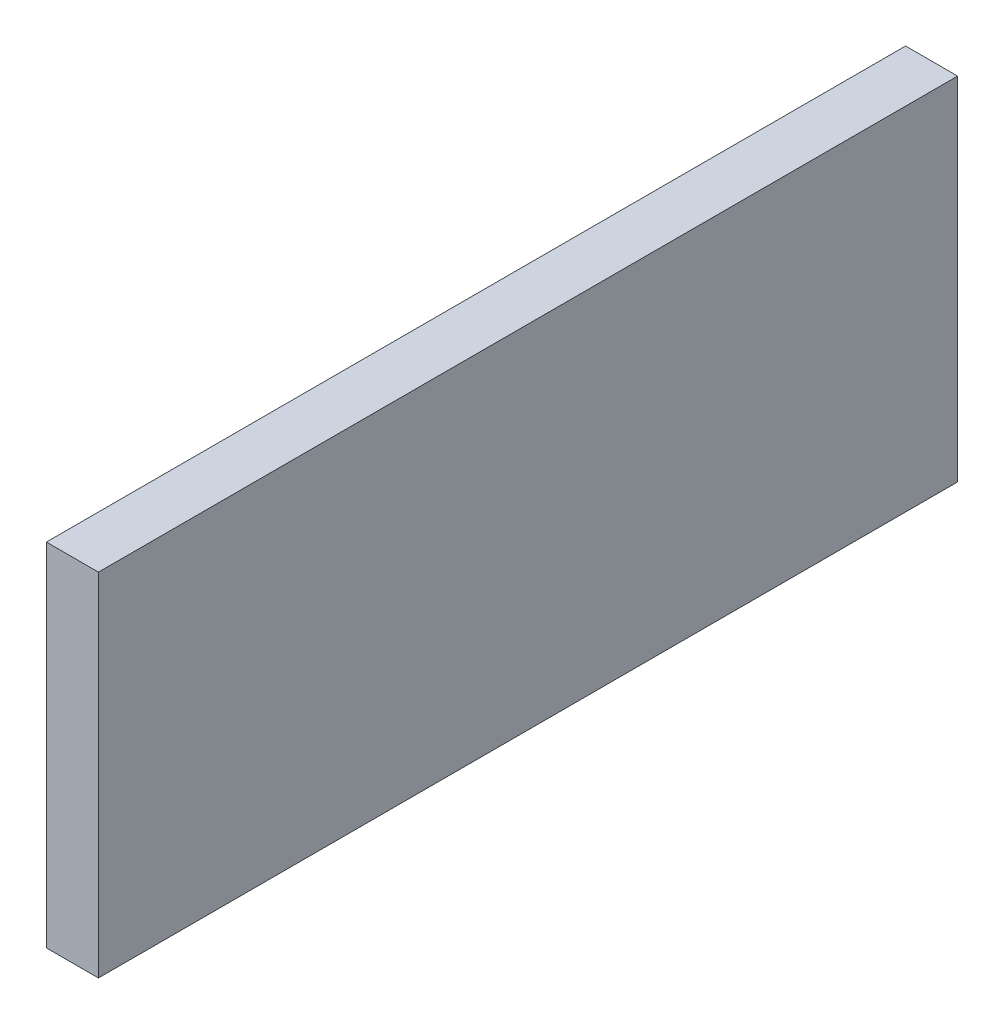
from build123d import *

# Parameters (mm, degrees)
SKETCH_1_W      = 160
SKETCH_1_H      = 1080
EXTRUDE_1_DEPTH = 2640


with BuildPart() as part:
    # Эскиз1 → Бобышка-Вытянуть1 (new body)
    with BuildSketch(Plane.XY):
        with Locations((480, 6080)):
            Rectangle(SKETCH_1_W, SKETCH_1_H)
    extrude(amount=EXTRUDE_1_DEPTH)


solid = part.part
